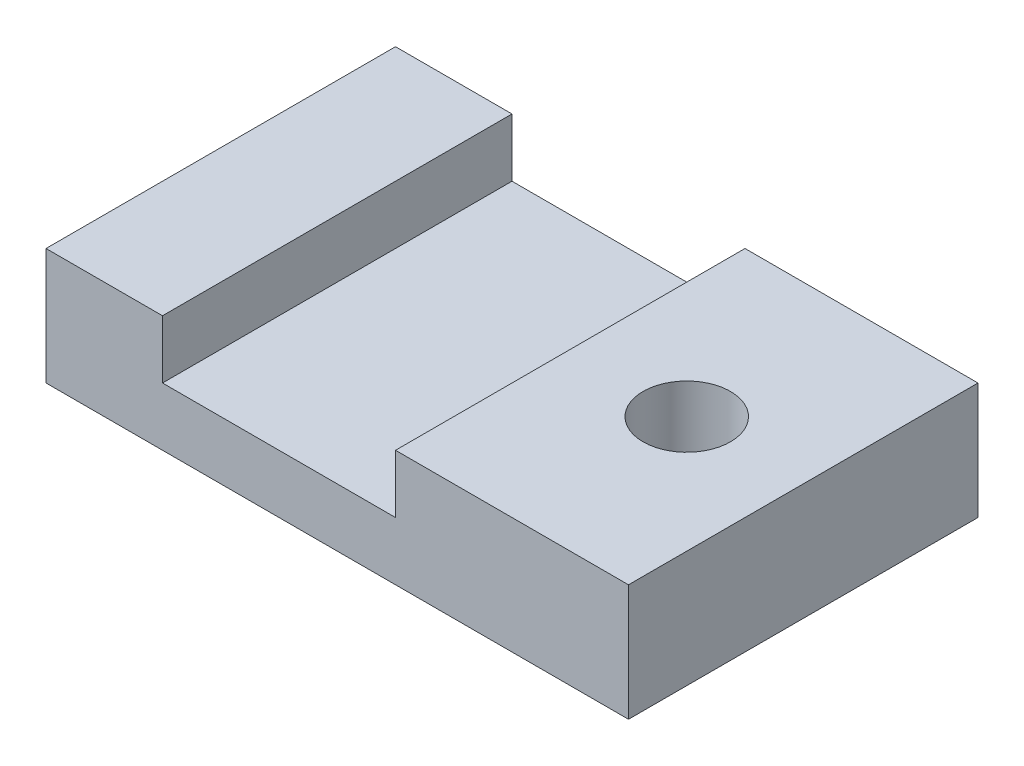
from build123d import *

# Parameters (mm, degrees)
BOSS_EXTRUDE1_DEPTH = 76.2
SKETCH3_R           = 9.525
CUT_EXTRUDE1_DEPTH  = 151.268426491


with BuildPart() as part:
    # Sketch2 → Boss-Extrude1 (new body)
    with BuildSketch(Plane.XY):
        Polygon((25.4, 25.4), (25.4, 12.7), (76.2, 12.7), (76.2, 25.4), (127, 25.4), (127, 0), (0, 0), (0, 25.4), align=None)
    extrude(amount=-BOSS_EXTRUDE1_DEPTH)

    # Sketch3 → Cut-Extrude1 (cut, through all)
    with BuildSketch(Plane(origin=(0, 25.4, 0), x_dir=(1, 0, 0), z_dir=(0, 1, 0))):
        with Locations(Location((101.6, 38.1, 0), (0, 0, 270))):
            Circle(SKETCH3_R)
    extrude(amount=-CUT_EXTRUDE1_DEPTH, mode=Mode.SUBTRACT)


solid = part.part
